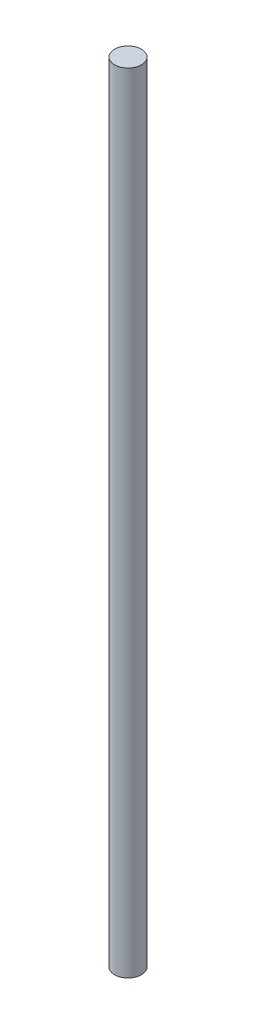
from build123d import *

# Parameters (mm, degrees)
SKETCH1_R           = 0.65
BOSS_EXTRUDE1_DEPTH = 38


with BuildPart() as part:
    # Sketch1 → Boss-Extrude1 (new body)
    with BuildSketch(Plane(origin=(0, 0, 0), x_dir=(1, 0, 0), z_dir=(0, 1, 0))):
        with Locations(Location((0, 0, 0), (0, 0, 270))):
            Circle(SKETCH1_R)
    extrude(amount=BOSS_EXTRUDE1_DEPTH)


solid = part.part
